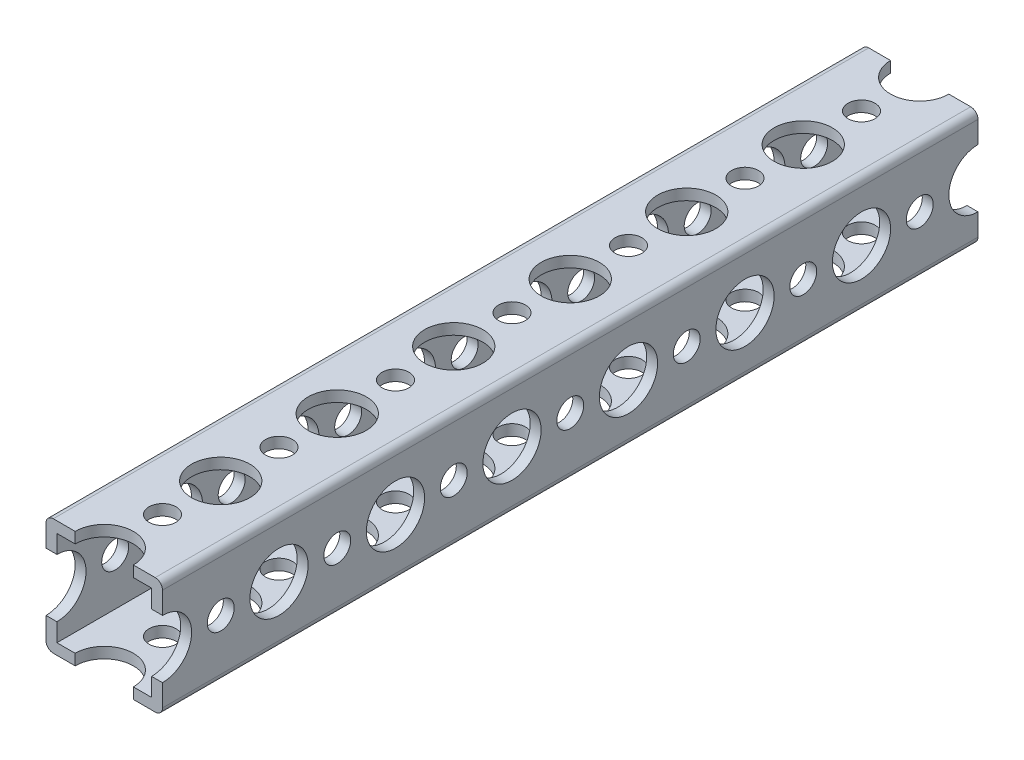
from build123d import *

# Parameters (mm, degrees)
SKETCH1_W      = 16
SKETCH1_H      = 16
EXTRUDE1_DEPTH = 112
SKETCH2_W      = 13
SKETCH2_H      = 13
EXTRUDE2_DEPTH = 115.262854857
SKETCH3_R      = 4
SKETCH3_R_2    = 1.85
EXTRUDE3_DEPTH = 115.262854857
SKETCH4_R      = 4
SKETCH4_R_2    = 1.85
EXTRUDE4_DEPTH = 115.262854857
FILLET1_R      = 1


with BuildPart() as part:
    # Sketch1 → Extrude1 (new body)
    with BuildSketch(Plane.XY):
        with Locations((8, 8)):
            Rectangle(SKETCH1_W, SKETCH1_H)
    extrude(amount=-EXTRUDE1_DEPTH)

    # Sketch2 → Extrude2 (cut, through all)
    with BuildSketch(Plane.XY):
        with Locations((8, 8)):
            Rectangle(SKETCH2_W, SKETCH2_H)
    extrude(amount=-EXTRUDE2_DEPTH, mode=Mode.SUBTRACT)

    # Sketch3 → Extrude3 (cut, through all)
    with BuildSketch(Plane(origin=(0, 16, 0), x_dir=(1, 0, 0), z_dir=(0, 1, 0))):
        with Locations(Location((8, 64, 0), (0, 0, 270))):
            Circle(SKETCH3_R)
        with Locations(Location((8, 32, 0), (0, 0, 270))):
            Circle(SKETCH3_R)
        with Locations((8, 0)):
            Circle(SKETCH3_R)
        with Locations(Location((8, 96, 0), (0, 0, 270))):
            Circle(SKETCH3_R)
        with Locations((8, 128)):
            Circle(SKETCH3_R)
        with Locations((8, 160)):
            Circle(SKETCH3_R)
        with Locations((8, 192)):
            Circle(SKETCH3_R)
        with Locations((8, 224)):
            Circle(SKETCH3_R)
        with Locations((8, 256)):
            Circle(SKETCH3_R)
        with Locations(Location((8, 48, 0), (0, 0, 270))):
            Circle(SKETCH3_R)
        with Locations(Location((8, 56, 0), (0, 0, 270))):
            Circle(SKETCH3_R_2)
        with Locations(Location((8, 40, 0), (0, 0, 270))):
            Circle(SKETCH3_R_2)
        with Locations(Location((8, 80, 0), (0, 0, 270))):
            Circle(SKETCH3_R)
        with Locations(Location((8, 88, 0), (0, 0, 270))):
            Circle(SKETCH3_R_2)
        with Locations(Location((8, 72, 0), (0, 0, 270))):
            Circle(SKETCH3_R_2)
        with Locations(Location((8, 16, 0), (0, 0, 270))):
            Circle(SKETCH3_R)
        with Locations(Location((8, 24, 0), (0, 0, 270))):
            Circle(SKETCH3_R_2)
        with Locations(Location((8, 8, 0), (0, 0, 270))):
            Circle(SKETCH3_R_2)
        with Locations((8, 112)):
            Circle(SKETCH3_R)
        with Locations((8, 120)):
            Circle(SKETCH3_R_2)
        with Locations(Location((8, 104, 0), (0, 0, 270))):
            Circle(SKETCH3_R_2)
        with Locations((8, 144)):
            Circle(SKETCH3_R)
        with Locations((8, 152)):
            Circle(SKETCH3_R_2)
        with Locations((8, 136)):
            Circle(SKETCH3_R_2)
        with Locations((8, 176)):
            Circle(SKETCH3_R)
        with Locations((8, 184)):
            Circle(SKETCH3_R_2)
        with Locations((8, 168)):
            Circle(SKETCH3_R_2)
        with Locations((8, 208)):
            Circle(SKETCH3_R)
        with Locations((8, 216)):
            Circle(SKETCH3_R_2)
        with Locations((8, 200)):
            Circle(SKETCH3_R_2)
        with Locations((8, 240)):
            Circle(SKETCH3_R)
        with Locations((8, 248)):
            Circle(SKETCH3_R_2)
        with Locations((8, 232)):
            Circle(SKETCH3_R_2)
    extrude(amount=-EXTRUDE3_DEPTH, mode=Mode.SUBTRACT)

    # Sketch4 → Extrude4 (cut, through all)
    with BuildSketch(Plane(origin=(16, 0, 0), x_dir=(0, 0, -1), z_dir=(1, 0, 0))):
        with Locations(Location((32, 8, 0), (0, 0, 90))):
            Circle(SKETCH4_R)
        with Locations(Location((64, 8, 0), (0, 0, 90))):
            Circle(SKETCH4_R)
        with Locations((0, 8)):
            Circle(SKETCH4_R)
        with Locations(Location((96, 8, 0), (0, 0, 90))):
            Circle(SKETCH4_R)
        with Locations((128, 8)):
            Circle(SKETCH4_R)
        with Locations((160, 8)):
            Circle(SKETCH4_R)
        with Locations((192, 8)):
            Circle(SKETCH4_R)
        with Locations((224, 8)):
            Circle(SKETCH4_R)
        with Locations((256, 8)):
            Circle(SKETCH4_R)
        with Locations(Location((48, 8.074203, 0), (0, 0, 90))):
            Circle(SKETCH4_R)
        with Locations(Location((40, 8.074203, 0), (0, 0, 90))):
            Circle(SKETCH4_R_2)
        with Locations(Location((56, 8.074203, 0), (0, 0, 90))):
            Circle(SKETCH4_R_2)
        with Locations(Location((80, 8, 0), (0, 0, 90))):
            Circle(SKETCH4_R)
        with Locations(Location((72, 8, 0), (0, 0, 90))):
            Circle(SKETCH4_R_2)
        with Locations(Location((88, 8, 0), (0, 0, 90))):
            Circle(SKETCH4_R_2)
        with Locations(Location((16, 8, 0), (0, 0, 90))):
            Circle(SKETCH4_R)
        with Locations(Location((8, 8, 0), (0, 0, 90))):
            Circle(SKETCH4_R_2)
        with Locations(Location((24, 8, 0), (0, 0, 90))):
            Circle(SKETCH4_R_2)
        with Locations((112, 8)):
            Circle(SKETCH4_R)
        with Locations(Location((104, 8, 0), (0, 0, 90))):
            Circle(SKETCH4_R_2)
        with Locations((120, 8)):
            Circle(SKETCH4_R_2)
        with Locations((144, 8)):
            Circle(SKETCH4_R)
        with Locations((136, 8)):
            Circle(SKETCH4_R_2)
        with Locations((152, 8)):
            Circle(SKETCH4_R_2)
        with Locations((176, 8)):
            Circle(SKETCH4_R)
        with Locations((168, 8)):
            Circle(SKETCH4_R_2)
        with Locations((184, 8)):
            Circle(SKETCH4_R_2)
        with Locations((208, 8)):
            Circle(SKETCH4_R)
        with Locations((200, 8)):
            Circle(SKETCH4_R_2)
        with Locations((216, 8)):
            Circle(SKETCH4_R_2)
        with Locations((240, 8)):
            Circle(SKETCH4_R)
        with Locations((232, 8)):
            Circle(SKETCH4_R_2)
        with Locations((248, 8)):
            Circle(SKETCH4_R_2)
    extrude(amount=-EXTRUDE4_DEPTH, mode=Mode.SUBTRACT)

    # Fillet1
    fillet1_edges = [part.edges().sort_by_distance(p)[0] for p in [
        (0, 16, -56),
        (16, 16, -56),
        (16, 0, -56),
        (0, 0, -56),
    ]]
    fillet(fillet1_edges, radius=FILLET1_R)


solid = part.part
